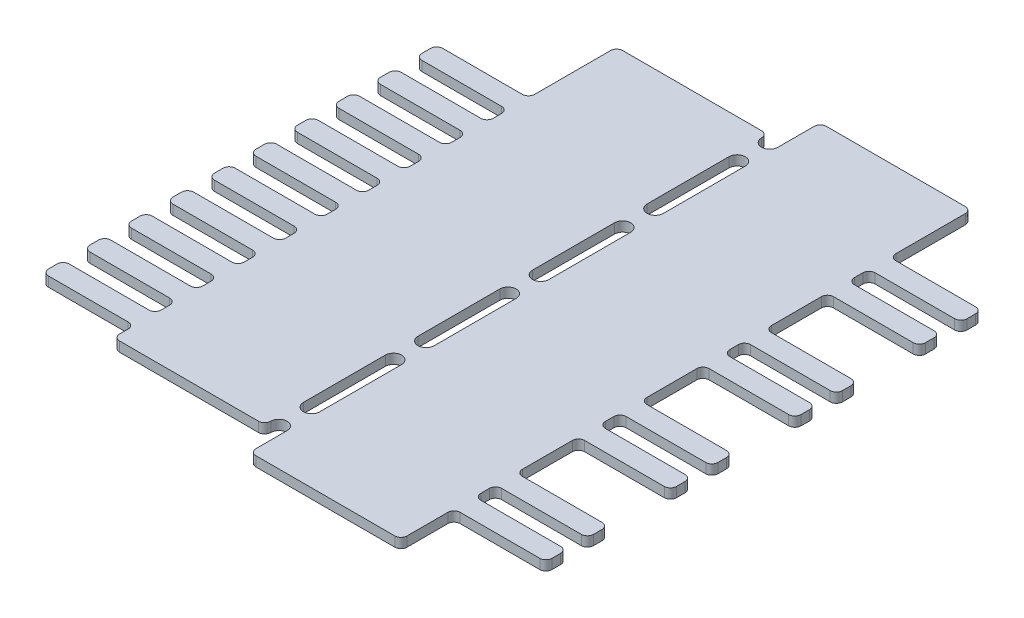
from build123d import *

# Parameters (mm, degrees)
BOSS_EXTRUDE1_DEPTH   = 1.2
CUT_EXTRUDE1_DEPTH    = 87.047243419
BODY_MOVE_COPY1_ANGLE = 180


with BuildPart() as part:
    # Sketch1 → Boss-Extrude1 (new body)
    with BuildSketch(Plane(origin=(0, 0, 0), x_dir=(1, 0, 0), z_dir=(0, 1, 0))):
        with BuildLine():
            Line((-0.75, 10), (-10.5, 10))
            ThreePointArc((-10.5, 10), (-11.030330086, 10.219669914), (-11.25, 10.75))
            Line((-11.25, 10.75), (-11.25, 11.79))
            ThreePointArc((-11.25, 11.79), (-11.030330086, 12.320330086), (-10.5, 12.54))
            Line((-10.5, 12.54), (-0.75, 12.54))
            ThreePointArc((-0.75, 12.54), (-0.219669914, 12.759669914), (0, 13.29))
            Line((0, 13.29), (0, 14.33))
            ThreePointArc((0, 14.33), (-0.219669914, 14.860330086), (-0.75, 15.08))
            Line((-0.75, 15.08), (-10.5, 15.08))
            ThreePointArc((-10.5, 15.08), (-11.030330086, 15.299669914), (-11.25, 15.83))
            Line((-11.25, 15.83), (-11.25, 16.87))
            ThreePointArc((-11.25, 16.87), (-11.030330086, 17.400330086), (-10.5, 17.62))
            Line((-10.5, 17.62), (-0.75, 17.62))
            ThreePointArc((-0.75, 17.62), (-0.219669914, 17.839669914), (0, 18.37))
            Line((0, 18.37), (0, 24.49))
            ThreePointArc((0, 24.49), (-0.219669914, 25.020330086), (-0.75, 25.24))
            Line((-0.75, 25.24), (-10.5, 25.24))
            ThreePointArc((-10.5, 25.24), (-11.030330086, 25.459669914), (-11.25, 25.99))
            Line((-11.25, 25.99), (-11.25, 27.03))
            ThreePointArc((-11.25, 27.03), (-11.030330086, 27.560330086), (-10.5, 27.78))
            Line((-10.5, 27.78), (-0.75, 27.78))
            ThreePointArc((-0.75, 27.78), (-0.219669914, 27.999669914), (0, 28.53))
            Line((0, 28.53), (0, 29.57))
            ThreePointArc((0, 29.57), (-0.219669914, 30.100330086), (-0.75, 30.32))
            Line((-0.75, 30.32), (-10.5, 30.32))
            ThreePointArc((-10.5, 30.32), (-11.030330086, 30.539669914), (-11.25, 31.07))
            Line((-11.25, 31.07), (-11.25, 32.11))
            ThreePointArc((-11.25, 32.11), (-11.030330086, 32.640330086), (-10.5, 32.86))
            Line((-10.5, 32.86), (-0.75, 32.86))
            ThreePointArc((-0.75, 32.86), (-0.219669914, 33.079669914), (0, 33.61))
            Line((0, 33.61), (0, 39.73))
            ThreePointArc((0, 39.73), (-0.219669914, 40.260330086), (-0.75, 40.48))
            Line((-0.75, 40.48), (-10.5, 40.48))
            ThreePointArc((-10.5, 40.48), (-11.030330086, 40.699669914), (-11.25, 41.23))
            Line((-11.25, 41.23), (-11.25, 42.27))
            ThreePointArc((-11.25, 42.27), (-11.030330086, 42.800330086), (-10.5, 43.02))
            Line((-10.5, 43.02), (-0.75, 43.02))
            ThreePointArc((-0.75, 43.02), (-0.219669914, 43.239669914), (0, 43.77))
            Line((0, 43.77), (0, 44.81))
            ThreePointArc((0, 44.81), (-0.219669914, 45.340330086), (-0.75, 45.56))
            Line((-0.75, 45.56), (-10.5, 45.56))
            ThreePointArc((-10.5, 45.56), (-11.030330086, 45.779669914), (-11.25, 46.31))
            Line((-11.25, 46.31), (-11.25, 47.35))
            ThreePointArc((-11.25, 47.35), (-11.030330086, 47.880330086), (-10.5, 48.1))
            Line((-10.5, 48.1), (-0.75, 48.1))
            ThreePointArc((-0.75, 48.1), (-0.219669914, 48.319669914), (0, 48.85))
            Line((0, 48.85), (0, 54.97))
            ThreePointArc((0, 54.97), (-0.219669914, 55.500330086), (-0.75, 55.72))
            Line((-0.75, 55.72), (-10.5, 55.72))
            ThreePointArc((-10.5, 55.72), (-11.030330086, 55.939669914), (-11.25, 56.47))
            Line((-11.25, 56.47), (-11.25, 57.51))
            ThreePointArc((-11.25, 57.51), (-11.030330086, 58.040330086), (-10.5, 58.26))
            Line((-10.5, 58.26), (-0.75, 58.26))
            ThreePointArc((-0.75, 58.26), (-0.219669914, 58.479669914), (0, 59.01))
            Line((0, 59.01), (0, 60.05))
            ThreePointArc((0, 60.05), (-0.219669914, 60.580330086), (-0.75, 60.8))
            Line((-0.75, 60.8), (-10.5, 60.8))
            ThreePointArc((-10.5, 60.8), (-11.030330086, 61.019669914), (-11.25, 61.55))
            Line((-11.25, 61.55), (-11.25, 62.59))
            ThreePointArc((-11.25, 62.59), (-11.030330086, 63.120330086), (-10.5, 63.34))
            Line((-10.5, 63.34), (-0.75, 63.34))
            ThreePointArc((-0.75, 63.34), (-0.219669914, 63.559669914), (0, 64.09))
            Line((0, 64.09), (0, 69.09))
            ThreePointArc((0, 69.09), (0.219669914, 69.620330086), (0.75, 69.84))
            Line((0.75, 69.84), (17.75, 69.84))
            ThreePointArc((17.75, 69.84), (18.280330086, 69.620330086), (18.5, 69.09))
            Line((18.5, 69.09), (18.5, 65.27050991))
            ThreePointArc((18.5, 65.27050991), (19.5, 64.27050991), (20.5, 65.27050991))
            ThreePointArc((20.5, 65.27050991), (20.719669914, 65.800839996), (21.25, 66.02050991))
            Line((21.25, 66.02050991), (38.25, 66.02050991))
            ThreePointArc((38.25, 66.02050991), (38.780330086, 65.800839996), (39, 65.27050991))
            Line((39, 65.27050991), (39, 64.23050991))
            ThreePointArc((39, 64.23050991), (39.219669914, 63.700179824), (39.75, 63.48050991))
            Line((39.75, 63.48050991), (49.5, 63.48050991))
            ThreePointArc((49.5, 63.48050991), (50.030330086, 63.260839996), (50.25, 62.73050991))
            Line((50.25, 62.73050991), (50.25, 61.69050991))
            ThreePointArc((50.25, 61.69050991), (50.030330086, 61.160179824), (49.5, 60.94050991))
            Line((49.5, 60.94050991), (39.75, 60.94050991))
            ThreePointArc((39.75, 60.94050991), (39.219669914, 60.720839996), (39, 60.19050991))
            Line((39, 60.19050991), (39, 59.15050991))
            ThreePointArc((39, 59.15050991), (39.219669914, 58.620179824), (39.75, 58.40050991))
            Line((39.75, 58.40050991), (49.5, 58.40050991))
            ThreePointArc((49.5, 58.40050991), (50.030330086, 58.180839996), (50.25, 57.65050991))
            Line((50.25, 57.65050991), (50.25, 56.61050991))
            ThreePointArc((50.25, 56.61050991), (50.030330086, 56.080179824), (49.5, 55.86050991))
            Line((49.5, 55.86050991), (39.75, 55.86050991))
            ThreePointArc((39.75, 55.86050991), (39.219669914, 55.640839996), (39, 55.11050991))
            Line((39, 55.11050991), (39, 54.07050991))
            ThreePointArc((39, 54.07050991), (39.219669914, 53.540179824), (39.75, 53.32050991))
            Line((39.75, 53.32050991), (49.5, 53.32050991))
            ThreePointArc((49.5, 53.32050991), (50.030330086, 53.100839996), (50.25, 52.57050991))
            Line((50.25, 52.57050991), (50.25, 51.53050991))
            ThreePointArc((50.25, 51.53050991), (50.030330086, 51.000179824), (49.5, 50.78050991))
            Line((49.5, 50.78050991), (39.75, 50.78050991))
            ThreePointArc((39.75, 50.78050991), (39.219669914, 50.560839996), (39, 50.03050991))
            Line((39, 50.03050991), (39, 48.99050991))
            ThreePointArc((39, 48.99050991), (39.219669914, 48.460179824), (39.75, 48.24050991))
            Line((39.75, 48.24050991), (49.5, 48.24050991))
            ThreePointArc((49.5, 48.24050991), (50.030330086, 48.020839996), (50.25, 47.49050991))
            Line((50.25, 47.49050991), (50.25, 46.45050991))
            ThreePointArc((50.25, 46.45050991), (50.030330086, 45.920179824), (49.5, 45.70050991))
            Line((49.5, 45.70050991), (39.75, 45.70050991))
            ThreePointArc((39.75, 45.70050991), (39.219669914, 45.480839996), (39, 44.95050991))
            Line((39, 44.95050991), (39, 43.91050991))
            ThreePointArc((39, 43.91050991), (39.219669914, 43.380179824), (39.75, 43.16050991))
            Line((39.75, 43.16050991), (49.5, 43.16050991))
            ThreePointArc((49.5, 43.16050991), (50.030330086, 42.940839996), (50.25, 42.41050991))
            Line((50.25, 42.41050991), (50.25, 41.37050991))
            ThreePointArc((50.25, 41.37050991), (50.030330086, 40.840179824), (49.5, 40.62050991))
            Line((49.5, 40.62050991), (39.75, 40.62050991))
            ThreePointArc((39.75, 40.62050991), (39.219669914, 40.400839996), (39, 39.87050991))
            Line((39, 39.87050991), (39, 38.83050991))
            ThreePointArc((39, 38.83050991), (39.219669914, 38.300179824), (39.75, 38.08050991))
            Line((39.75, 38.08050991), (49.5, 38.08050991))
            ThreePointArc((49.5, 38.08050991), (50.030330086, 37.860839996), (50.25, 37.33050991))
            Line((50.25, 37.33050991), (50.25, 36.29050991))
            ThreePointArc((50.25, 36.29050991), (50.030330086, 35.760179824), (49.5, 35.54050991))
            Line((49.5, 35.54050991), (39.75, 35.54050991))
            ThreePointArc((39.75, 35.54050991), (39.219669914, 35.320839996), (39, 34.79050991))
            Line((39, 34.79050991), (39, 33.75050991))
            ThreePointArc((39, 33.75050991), (39.219669914, 33.220179824), (39.75, 33.00050991))
            Line((39.75, 33.00050991), (49.5, 33.00050991))
            ThreePointArc((49.5, 33.00050991), (50.030330086, 32.780839996), (50.25, 32.25050991))
            Line((50.25, 32.25050991), (50.25, 31.21050991))
            ThreePointArc((50.25, 31.21050991), (50.030330086, 30.680179824), (49.5, 30.46050991))
            Line((49.5, 30.46050991), (39.75, 30.46050991))
            ThreePointArc((39.75, 30.46050991), (39.219669914, 30.240839996), (39, 29.71050991))
            Line((39, 29.71050991), (39, 28.67050991))
            ThreePointArc((39, 28.67050991), (39.219669914, 28.140179824), (39.75, 27.92050991))
            Line((39.75, 27.92050991), (49.5, 27.92050991))
            ThreePointArc((49.5, 27.92050991), (50.030330086, 27.700839996), (50.25, 27.17050991))
            Line((50.25, 27.17050991), (50.25, 26.13050991))
            ThreePointArc((50.25, 26.13050991), (50.030330086, 25.600179824), (49.5, 25.38050991))
            Line((49.5, 25.38050991), (39.75, 25.38050991))
            ThreePointArc((39.75, 25.38050991), (39.219669914, 25.160839996), (39, 24.63050991))
            Line((39, 24.63050991), (39, 23.59050991))
            ThreePointArc((39, 23.59050991), (39.219669914, 23.060179824), (39.75, 22.84050991))
            Line((39.75, 22.84050991), (49.5, 22.84050991))
            ThreePointArc((49.5, 22.84050991), (50.030330086, 22.620839996), (50.25, 22.09050991))
            Line((50.25, 22.09050991), (50.25, 21.05050991))
            ThreePointArc((50.25, 21.05050991), (50.030330086, 20.520179824), (49.5, 20.30050991))
            Line((49.5, 20.30050991), (39.75, 20.30050991))
            ThreePointArc((39.75, 20.30050991), (39.219669914, 20.080839996), (39, 19.55050991))
            Line((39, 19.55050991), (39, 18.51050991))
            ThreePointArc((39, 18.51050991), (39.219669914, 17.980179824), (39.75, 17.76050991))
            Line((39.75, 17.76050991), (49.5, 17.76050991))
            ThreePointArc((49.5, 17.76050991), (50.030330086, 17.540839996), (50.25, 17.01050991))
            Line((50.25, 17.01050991), (50.25, 15.97050991))
            ThreePointArc((50.25, 15.97050991), (50.030330086, 15.440179824), (49.5, 15.22050991))
            Line((49.5, 15.22050991), (39.75, 15.22050991))
            ThreePointArc((39.75, 15.22050991), (39.219669914, 15.000839996), (39, 14.47050991))
            Line((39, 14.47050991), (39, 5.18300671))
            ThreePointArc((39, 5.18300671), (38.780330086, 4.652676624), (38.25, 4.43300671))
            Line((38.25, 4.43300671), (21.25, 4.43300671))
            ThreePointArc((21.25, 4.43300671), (20.719669914, 4.652676624), (20.5, 5.18300671))
            ThreePointArc((20.5, 5.18300671), (19.5, 6.18300671), (18.5, 5.18300671))
            Line((18.5, 5.18300671), (18.5, 0.75))
            ThreePointArc((18.5, 0.75), (18.280330086, 0.219669914), (17.75, 0))
            Line((17.75, 0), (0.75, 0))
            ThreePointArc((0.75, 0), (0.219669914, 0.219669914), (0, 0.75))
            Line((0, 0.75), (0, 9.25))
            ThreePointArc((0, 9.25), (-0.219669914, 9.780330086), (-0.75, 10))
        make_face()
    extrude(amount=BOSS_EXTRUDE1_DEPTH)

    # Sketch2 → Cut-Extrude1 (cut, through all)
    with BuildSketch(Plane.XZ):
        with BuildLine():
            Line((18.5, -61.27050991), (18.5, -51.25050991))
            ThreePointArc((18.5, -51.25050991), (19.5, -50.25050991), (20.5, -51.25050991))
            Line((20.5, -51.25050991), (20.5, -61.27050991))
            ThreePointArc((20.5, -61.27050991), (19.5, -62.27050991), (18.5, -61.27050991))
        make_face()
        with BuildLine():
            Line((18.5, -47.25050991), (18.5, -37.23050991))
            ThreePointArc((18.5, -37.23050991), (19.5, -36.23050991), (20.5, -37.23050991))
            Line((20.5, -37.23050991), (20.5, -47.25050991))
            ThreePointArc((20.5, -47.25050991), (19.5, -48.25050991), (18.5, -47.25050991))
        make_face()
        with BuildLine():
            Line((18.5, -23.20300671), (18.5, -33.22300671))
            ThreePointArc((18.5, -33.22300671), (19.5, -34.22300671), (20.5, -33.22300671))
            Line((20.5, -33.22300671), (20.5, -23.20300671))
            ThreePointArc((20.5, -23.20300671), (19.5, -22.20300671), (18.5, -23.20300671))
        make_face()
        with BuildLine():
            Line((18.5, -9.18300671), (18.5, -19.20300671))
            ThreePointArc((18.5, -19.20300671), (19.5, -20.20300671), (20.5, -19.20300671))
            Line((20.5, -19.20300671), (20.5, -9.18300671))
            ThreePointArc((20.5, -9.18300671), (19.5, -8.18300671), (18.5, -9.18300671))
        make_face()
    extrude(amount=-CUT_EXTRUDE1_DEPTH, mode=Mode.SUBTRACT)


with BuildPart() as part_1:
    # Body-Move/Copy1: moved
    add(part.part.rotate(Axis((17.625, 0, -34.92), (0, 1, 0)), BODY_MOVE_COPY1_ANGLE))


solid = part_1.part
